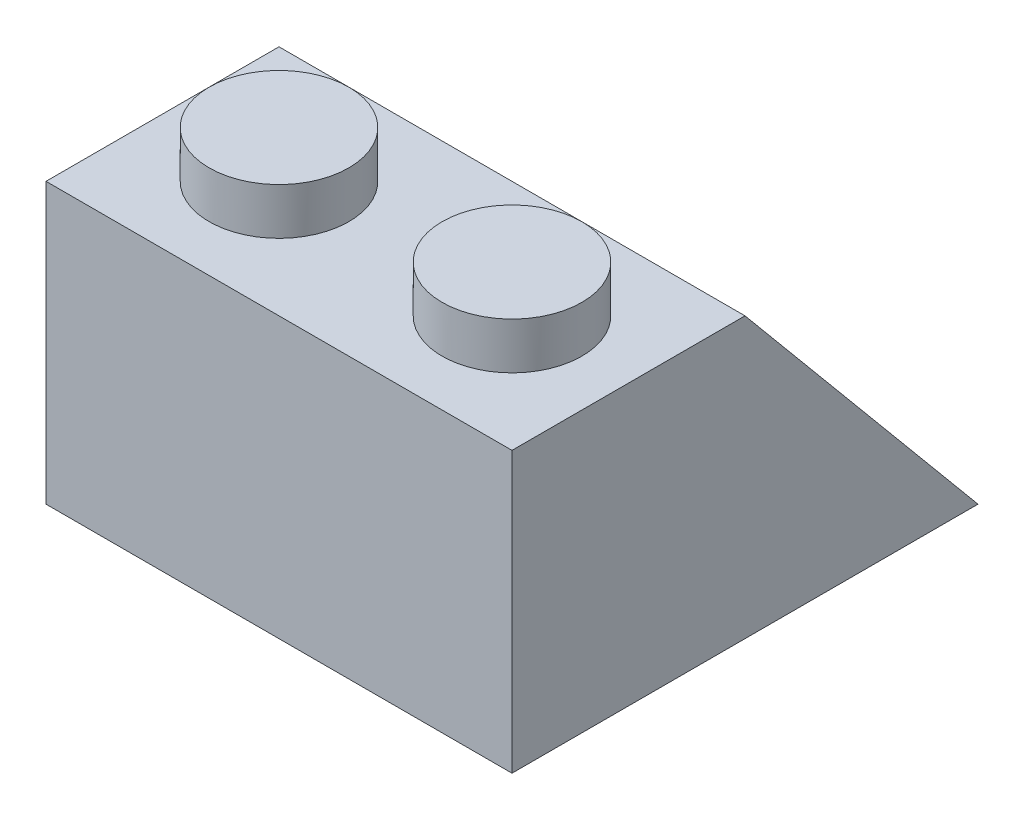
from build123d import *

# Parameters (mm, degrees)
BOSS_EXTRUDE1_DEPTH = 16
SKETCH2_R           = 2.4
BOSS_EXTRUDE2_DEPTH = 1.6
LPATTERN1_COUNT     = 2
LPATTERN1_PITCH     = 8
SHELL1_T            = -1.6


with BuildPart() as part:
    # Sketch1 → Boss-Extrude1 (new body)
    with BuildSketch(Plane(origin=(0, 0, 0), x_dir=(0, 0, -1), z_dir=(1, 0, 0))):
        Polygon((0, 0), (16, 0), (8, 9.6), (0, 9.6), align=None)
    extrude(amount=BOSS_EXTRUDE1_DEPTH)

    # Sketch2 → Boss-Extrude2 (add)
    with BuildSketch(Plane(origin=(0, 9.6, 0), x_dir=(1, 0, 0), z_dir=(0, 1, 0))):
        with Locations(Location((4, 4, 0), (0, 0, 90))):
            Circle(SKETCH2_R)
    boss_extrude2 = extrude(amount=BOSS_EXTRUDE2_DEPTH)

    # LPattern1: Boss-Extrude2 ×2
    with Locations(*[(i * LPATTERN1_PITCH, 0, 0) for i in range(1, LPATTERN1_COUNT)]):
        add(boss_extrude2)

    # Shell1
    shell1_openings = [part.faces().sort_by_distance(p)[0] for p in [
        (8, 0, -8),
    ]]
    offset(amount=SHELL1_T, openings=shell1_openings, kind=Kind.INTERSECTION)


solid = part.part
